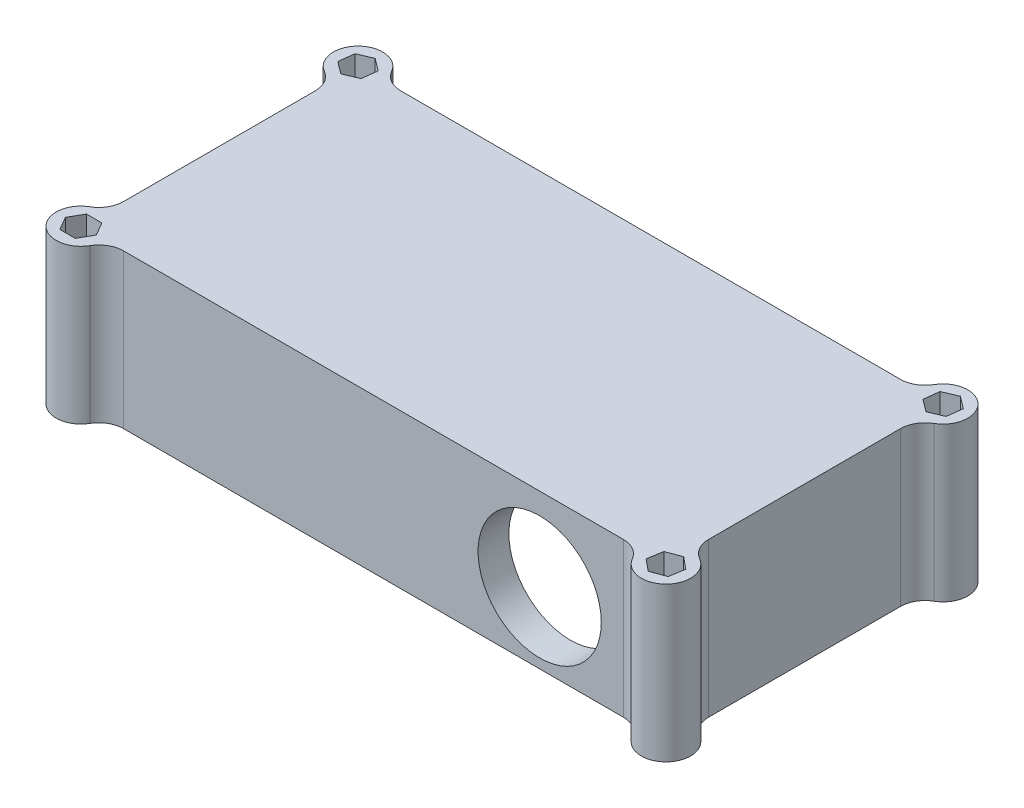
from build123d import *

# Parameters (mm, degrees)
SKETCH2_R           = 1.5
BOSS_EXTRUDE1_DEPTH = 25
FILLET3_R           = 4
FILLET4_R           = 4
FILLET5_R           = 4
FILLET6_R           = 4
FILLET7_R           = 4
FILLET8_R           = 4
FILLET9_R           = 4
FILLET10_R          = 4
CUT_EXTRUDE1_DEPTH  = 10
CUT_EXTRUDE2_DEPTH  = 20
SKETCH5_W           = 19.12768352
SKETCH5_H           = 10.876940682
CUT_EXTRUDE3_DEPTH  = 5
SKETCH6_R           = 10
CUT_EXTRUDE4_DEPTH  = 5


with BuildPart() as part:
    # Sketch2 → Boss-Extrude1 (new body)
    with BuildSketch(Plane(origin=(0, 0, 0), x_dir=(1, 0, 0), z_dir=(0, 1, 0))):
        with BuildLine():
            ThreePointArc((-43.5, 22.5), (-50.328427125, 25.328427125), (-47.5, 18.5))
            Line((-47.5, 18.5), (-47.5, -18.5))
            ThreePointArc((-47.5, -18.5), (-50.328427125, -25.328427125), (-43.5, -22.5))
            Line((-43.5, -22.5), (43.5, -22.5))
            ThreePointArc((43.5, -22.5), (50.328427125, -25.328427125), (47.5, -18.5))
            Line((47.5, -18.5), (47.5, 18.5))
            ThreePointArc((47.5, 18.5), (50.328427125, 25.328427125), (43.5, 22.5))
            Line((43.5, 22.5), (-43.5, 22.5))
        make_face()
        with Locations(Location((-47.5, 22.5, 0), (0, 0, 270))):
            Circle(SKETCH2_R, mode=Mode.SUBTRACT)
        with Locations(Location((-47.5, -22.5, 0), (0, 0, 270))):
            Circle(SKETCH2_R, mode=Mode.SUBTRACT)
        with Locations(Location((47.5, 22.5, 0), (0, 0, 270))):
            Circle(SKETCH2_R, mode=Mode.SUBTRACT)
        with Locations(Location((47.5, -22.5, 0), (0, 0, 270))):
            Circle(SKETCH2_R, mode=Mode.SUBTRACT)
    extrude(amount=BOSS_EXTRUDE1_DEPTH)

    # Fillet3
    fillet3_edges = [part.edges().sort_by_distance(p)[0] for p in [
        (-43.5, 12.5, -22.5),
    ]]
    fillet(fillet3_edges, radius=FILLET3_R)

    # Fillet4
    fillet4_edges = [part.edges().sort_by_distance(p)[0] for p in [
        (-47.5, 12.5, -18.5),
    ]]
    fillet(fillet4_edges, radius=FILLET4_R)

    # Fillet5
    fillet5_edges = [part.edges().sort_by_distance(p)[0] for p in [
        (47.5, 12.5, -18.5),
    ]]
    fillet(fillet5_edges, radius=FILLET5_R)

    # Fillet6
    fillet6_edges = [part.edges().sort_by_distance(p)[0] for p in [
        (43.5, 12.5, -22.5),
    ]]
    fillet(fillet6_edges, radius=FILLET6_R)

    # Fillet7
    fillet7_edges = [part.edges().sort_by_distance(p)[0] for p in [
        (47.5, 12.5, 18.5),
    ]]
    fillet(fillet7_edges, radius=FILLET7_R)

    # Fillet8
    fillet8_edges = [part.edges().sort_by_distance(p)[0] for p in [
        (43.5, 12.5, 22.5),
    ]]
    fillet(fillet8_edges, radius=FILLET8_R)

    # Fillet9
    fillet9_edges = [part.edges().sort_by_distance(p)[0] for p in [
        (-43.5, 12.5, 22.5),
    ]]
    fillet(fillet9_edges, radius=FILLET9_R)

    # Fillet10
    fillet10_edges = [part.edges().sort_by_distance(p)[0] for p in [
        (-47.5, 12.5, 18.5),
    ]]
    fillet(fillet10_edges, radius=FILLET10_R)

    # Sketch3 → Cut-Extrude1 (cut)
    with BuildSketch(Plane(origin=(0, 25, 0), x_dir=(1, 0, 0), z_dir=(0, 1, 0))):
        Polygon((45.159037956, -23.377437582), (47.089402215, -24.96605139), (49.430364258, -24.088613808), (49.840962044, -21.622562418), (47.910597785, -20.03394861), (45.569635742, -20.911386192), align=None)
        Polygon((45.198650859, 21.523377181), (47.1951056, 20.018661771), (49.496454742, 20.99528459), (49.801349141, 23.476622819), (47.8048944, 24.981338229), (45.503545258, 24.00471541), align=None)
        Polygon((-49.801349141, 21.523377181), (-47.8048944, 20.018661771), (-45.503545258, 20.99528459), (-45.198650859, 23.476622819), (-47.1951056, 24.981338229), (-49.496454742, 24.00471541), align=None)
        Polygon((-50, -22.5), (-48.75, -24.665063509), (-46.25, -24.665063509), (-45, -22.5), (-46.25, -20.334936491), (-48.75, -20.334936491), align=None)
    extrude(amount=-CUT_EXTRUDE1_DEPTH, mode=Mode.SUBTRACT)

    # Sketch4 → Cut-Extrude2 (cut)
    with BuildSketch(Plane.XZ):
        with BuildLine():
            Line((-42.5, 15.57179677), (-42.5, -15.57179677))
            ThreePointArc((-42.5, -15.57179677), (-42.568623197, -16.681079599), (-42.77344631, -17.77344631))
            ThreePointArc((-42.77344631, -17.77344631), (-41.681079599, -17.568623197), (-40.57179677, -17.5))
            Line((-40.57179677, -17.5), (40.57179677, -17.5))
            ThreePointArc((40.57179677, -17.5), (41.681079599, -17.568623197), (42.77344631, -17.77344631))
            ThreePointArc((42.77344631, -17.77344631), (42.568623197, -16.681079599), (42.5, -15.57179677))
            Line((42.5, -15.57179677), (42.5, 15.57179677))
            ThreePointArc((42.5, 15.57179677), (42.568623197, 16.681079599), (42.77344631, 17.77344631))
            ThreePointArc((42.77344631, 17.77344631), (41.681079599, 17.568623197), (40.57179677, 17.5))
            Line((40.57179677, 17.5), (-40.57179677, 17.5))
            ThreePointArc((-40.57179677, 17.5), (-41.681079599, 17.568623197), (-42.77344631, 17.77344631))
            ThreePointArc((-42.77344631, 17.77344631), (-42.568623197, 16.681079599), (-42.5, 15.57179677))
        make_face()
    extrude(amount=-CUT_EXTRUDE2_DEPTH, mode=Mode.SUBTRACT)

    # Sketch5 → Cut-Extrude3 (cut)
    with BuildSketch(Plane.ZY.offset(47.5)):
        with Locations((0.337516279, 13.061529659)):
            Rectangle(SKETCH5_W, SKETCH5_H)
    extrude(amount=-CUT_EXTRUDE3_DEPTH, mode=Mode.SUBTRACT)

    # Sketch6 → Cut-Extrude4 (cut)
    with BuildSketch(Plane.XY.offset(22.5)):
        with Locations((26.992807924, 11.532259518)):
            Circle(SKETCH6_R)
    extrude(amount=-CUT_EXTRUDE4_DEPTH, mode=Mode.SUBTRACT)


solid = part.part
